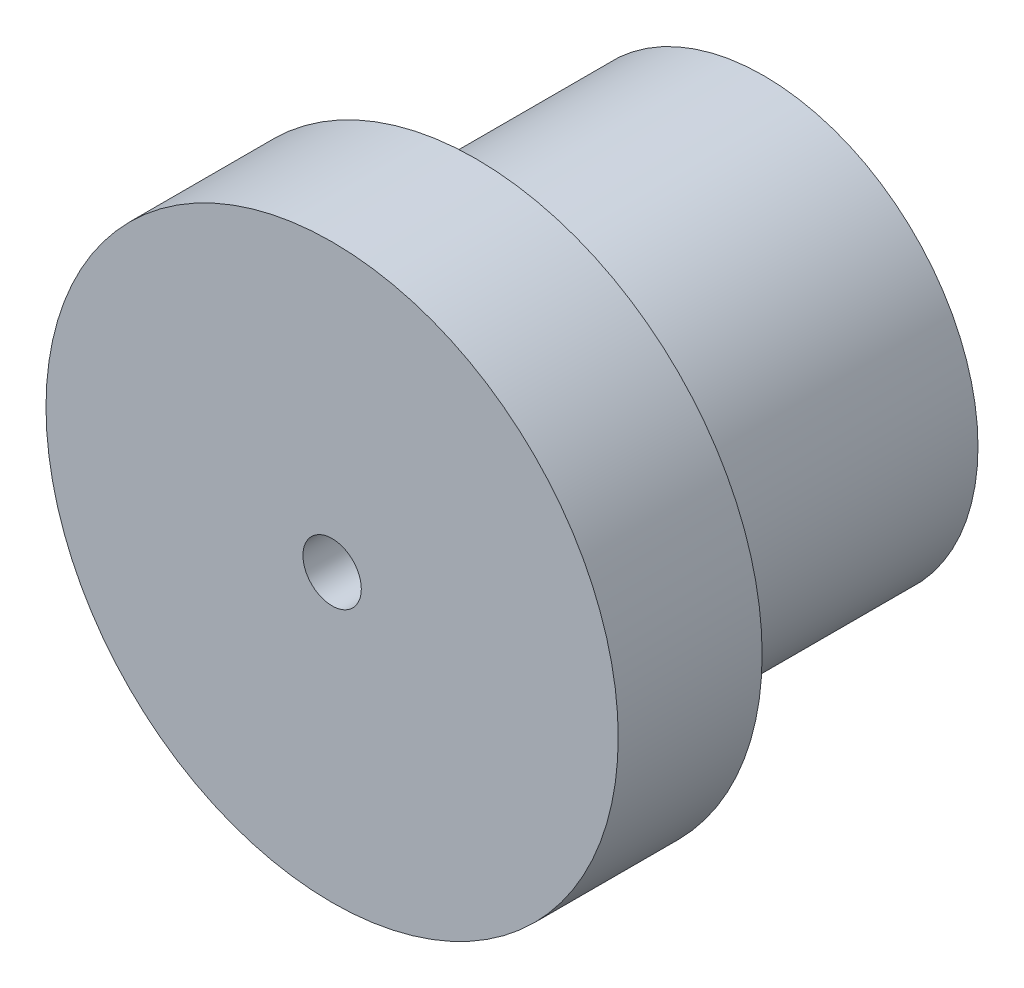
from build123d import *
from build123d.topology import SkipClean

# Parameters (mm, degrees)
SKETCH1_R           = 25.25
BOSS_EXTRUDE1_DEPTH = 12.7
SKETCH2_R           = 18.9
BOSS_EXTRUDE2_DEPTH = 25.4
SKETCH3_R           = 4.5
CUT_EXTRUDE1_DEPTH  = 13
CUT_EXTRUDE2_DEPTH  = 20
SKETCH5_R           = 2.575
CUT_EXTRUDE3_DEPTH  = 5


with BuildPart() as part:
    # Sketch1 → Boss-Extrude1 (new body)
    with BuildSketch(Plane.XY):
        Circle(SKETCH1_R)
    extrude(amount=-BOSS_EXTRUDE1_DEPTH)

    # Sketch2 → Boss-Extrude2 (add)
    with BuildSketch(Plane(origin=(0, 0, -12.7), x_dir=(-1, 0, 0), z_dir=(0, 0, -1))):
        with Locations(Location((0, 0, 0), (0, 0, 180))):
            Circle(SKETCH2_R)
    extrude(amount=BOSS_EXTRUDE2_DEPTH)

    # Sketch3 → Cut-Extrude1 (cut)
    with BuildSketch(Plane(origin=(0, 0, -38.1), x_dir=(-1, 0, 0), z_dir=(0, 0, -1))):
        Circle(SKETCH3_R)
    extrude(amount=-CUT_EXTRUDE1_DEPTH, mode=Mode.SUBTRACT)

    # Sketch4 → Cut-Extrude2 (cut)
    with BuildSketch(Plane.XY):
        with BuildLine():
            Line((-2.24, 1.270049212), (2.24, 1.270049212))
            ThreePointArc((2.24, 1.270049212), (0, -2.575), (-2.24, 1.270049212))
        make_face()
    extrude(amount=-CUT_EXTRUDE2_DEPTH, mode=Mode.SUBTRACT)

    # Sketch5 → Cut-Extrude3 (cut)
    with SkipClean():  # the faces are left unmerged after this step: merging them gives an invalid solid
        with BuildSketch(Plane.XY):
            Circle(SKETCH5_R)
        extrude(amount=-CUT_EXTRUDE3_DEPTH, mode=Mode.SUBTRACT)


solid = part.part
